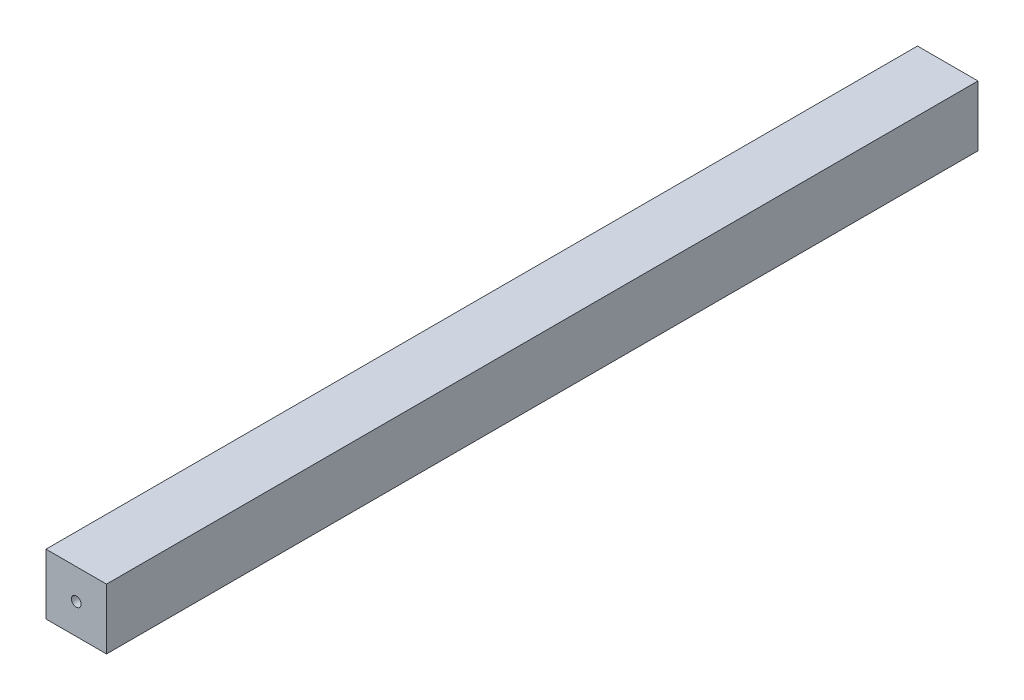
from build123d import *

# Parameters (mm, degrees)
SKETCH1_W           = 50
SKETCH1_H           = 50
BOSS_EXTRUDE1_DEPTH = 720
SKETCH2_R           = 4
CUT_EXTRUDE1_DEPTH  = 30
SKETCH3_W           = 50
SKETCH3_H           = 50
BOSS_EXTRUDE2_DEPTH = 720
SKETCH4_R           = 4
CUT_EXTRUDE2_DEPTH  = 30


with BuildPart() as part:
    # Sketch1 → Boss-Extrude1 (new body)
    with BuildSketch(Plane.XY):
        Rectangle(SKETCH1_W, SKETCH1_H)
    extrude(amount=BOSS_EXTRUDE1_DEPTH)

    # Sketch2 → Cut-Extrude1 (cut)
    with BuildSketch(Plane.XY.offset(720)):
        Circle(SKETCH2_R)
    extrude(amount=-CUT_EXTRUDE1_DEPTH, mode=Mode.SUBTRACT)

    # Sketch3 → Boss-Extrude2 (add)
    with BuildSketch(Plane.XY):
        Rectangle(SKETCH3_W, SKETCH3_H)
    extrude(amount=BOSS_EXTRUDE2_DEPTH)

    # Sketch4 → Cut-Extrude2 (cut)
    with BuildSketch(Plane.XY.offset(720)):
        Circle(SKETCH4_R)
    extrude(amount=-CUT_EXTRUDE2_DEPTH, mode=Mode.SUBTRACT)


solid = part.part
